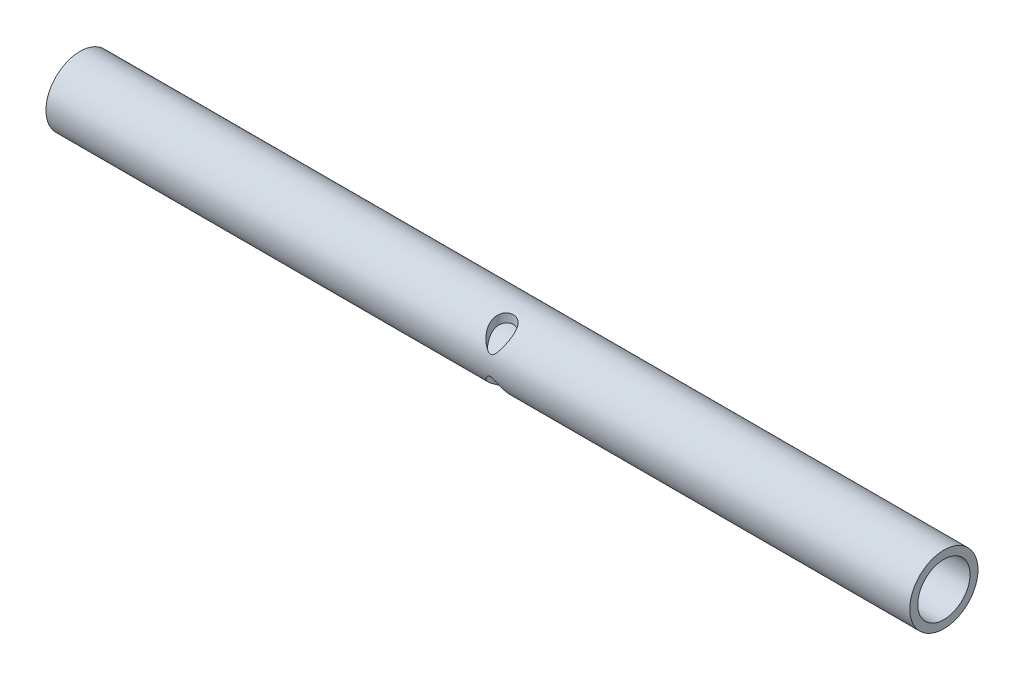
from build123d import *

# Parameters (mm, degrees)
BOSS_EXTRUDE1_DEPTH      = 38.608
BOSS_EXTRUDE1_DEPTH_BACK = 38.608
SKETCH1_R                = 3.048
SKETCH1_R_2              = 2.3368
CUT_EXTRUDE2_DEPTH       = 41.048822588
CUT_EXTRUDE2_DEPTH_BACK  = 41.048822588
SKETCH4_R                = 1.016


with BuildPart() as part:
    # Sketch1 → Boss-Extrude1 (new, two sides: drawn at the far end of the back side and taken through both)
    with BuildSketch(Plane(origin=(0, 0, 0), x_dir=(0, 0, -1), z_dir=(1, 0, 0)).offset(-BOSS_EXTRUDE1_DEPTH_BACK)):
        Circle(SKETCH1_R)
        Circle(SKETCH1_R_2, mode=Mode.SUBTRACT)
    extrude(amount=BOSS_EXTRUDE1_DEPTH + BOSS_EXTRUDE1_DEPTH_BACK)

    # Sketch4 → Cut-Extrude2 (cut, two sides: drawn at the far end of the back side and taken through both)
    with BuildSketch(Plane(origin=(1.015999977, 0, 1.907452801), x_dir=(0.9780710689611325, 0, -0.20827141921355355), z_dir=(0, -1, 0)).offset(-CUT_EXTRUDE2_DEPTH_BACK)):
        Circle(SKETCH4_R)
    extrude(amount=CUT_EXTRUDE2_DEPTH + CUT_EXTRUDE2_DEPTH_BACK, mode=Mode.SUBTRACT)


solid = part.part
